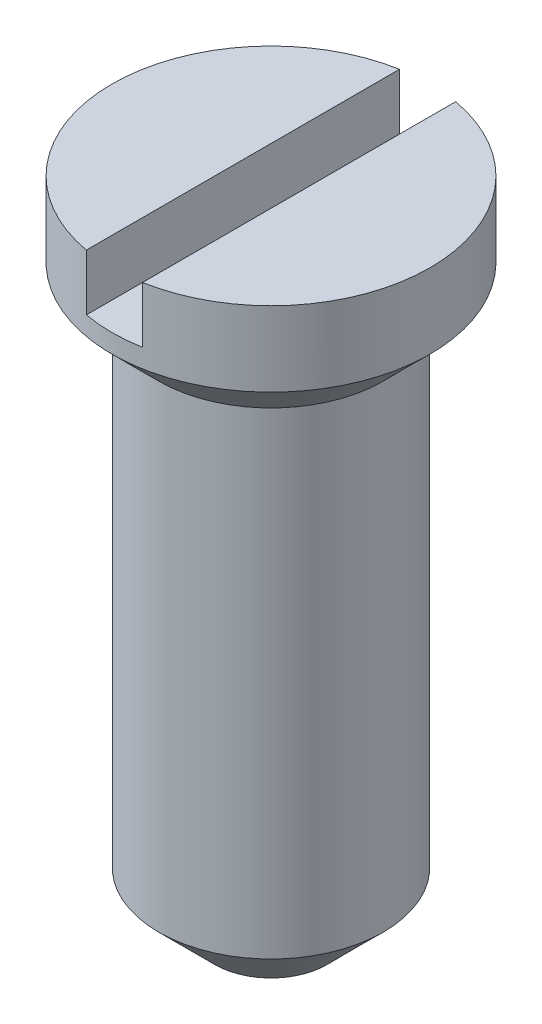
from build123d import *

# Parameters (mm, degrees)
SKETCH2_R           = 0.85
BOSS_EXTRUDE1_DEPTH = 3.5
CHAMFER1_SIZE       = 0.3
SKETCH4_W           = 0.3
SKETCH4_H           = 1.9
CUT_EXTRUDE1_DEPTH  = 0.3


with BuildPart() as part:
    # Sketch2 → Boss-Extrude1 (new body)
    with BuildSketch(Plane(origin=(0, 0, 0), x_dir=(1, 0, 0), z_dir=(0, 1, 0))):
        with Locations(Location((0, 0, 0), (0, 0, 270))):
            Circle(SKETCH2_R)
    extrude(amount=BOSS_EXTRUDE1_DEPTH)

    # Sketch3 → Cut-Revolve1 (revolve, cut)
    with BuildSketch(Plane.XY, mode=Mode.PRIVATE) as cut_revolve1_sk:
        Polygon((0.85, 3.1), (0.6, 2.85), (0.6, 0), (0.85, 0), align=None)
    revolve(cut_revolve1_sk.sketch.rotate(Axis((0, 0, 0), (0, 1, 0)), 90), axis=Axis((0, 0, 0), (0, 1, 0)), mode=Mode.SUBTRACT)

    # Chamfer1
    chamfer1_edges = [part.edges().sort_by_distance(p)[0] for p in [
        (0, 0, 0.6),
    ]]
    chamfer(chamfer1_edges, length=CHAMFER1_SIZE)

    # Sketch4 → Cut-Extrude1 (cut)
    with BuildSketch(Plane(origin=(0, 3.5, 0), x_dir=(1, 0, 0), z_dir=(0, 1, 0))):
        Rectangle(SKETCH4_W, SKETCH4_H)
    extrude(amount=-CUT_EXTRUDE1_DEPTH, mode=Mode.SUBTRACT)


solid = part.part
